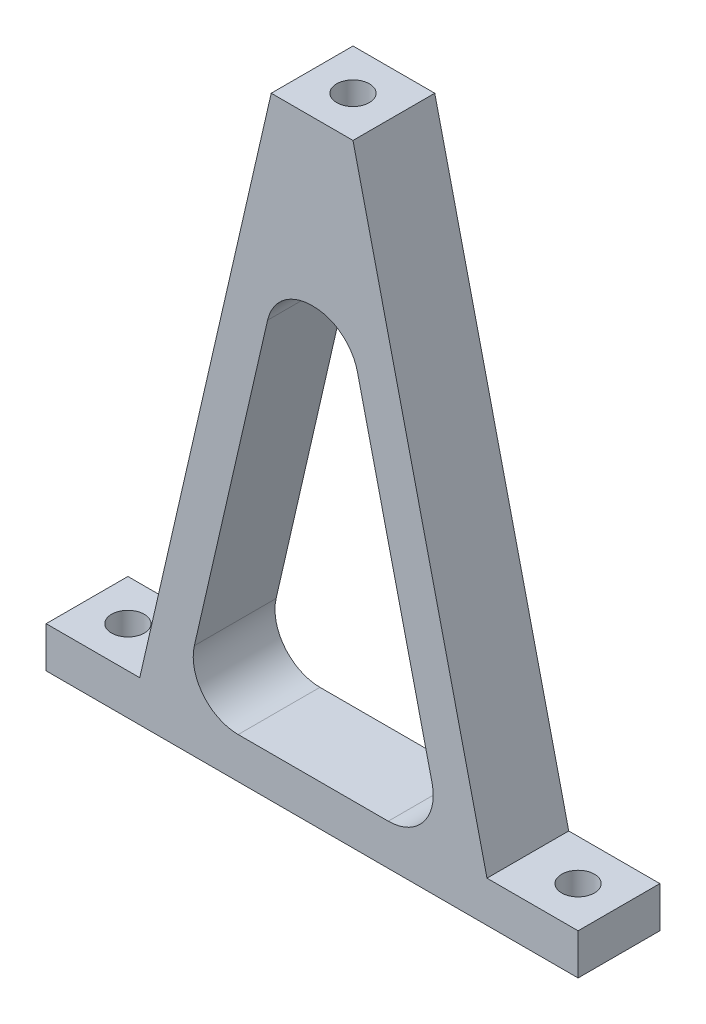
from build123d import *

# Parameters (mm, degrees)
BOSS_EXTRUDE1_DEPTH            = 3
BOSS_EXTRUDE1_DEPTH_BACK       = 7
BOSS_EXTRUDE2_DEPTH            = 3
BOSS_EXTRUDE2_DEPTH_BACK       = 7
SKETCH1_3_W                    = 65.055522872
SKETCH1_3_H                    = 5
CUT_EXTRUDE1_REACH             = 79.455
SKETCH2_R                      = 2
CUT_EXTRUDE2_REACH             = 62.059
CUT_EXTRUDE2_DIRECTION_2_REACH = 62.059
FILLET4_R                      = 5.5
CUT_EXTRUDE3_REACH             = 83.998
SKETCH4_R                      = 2


with BuildPart() as part:
    # Sketch1 → Boss-Extrude1 (new, two sides: drawn at the far end of the back side and taken through both)
    with BuildSketch(Plane.XY.offset(-BOSS_EXTRUDE1_DEPTH_BACK)):
        Polygon((5, 24.943962348), (-5, 24.943962348), (-21.080707518, -45), (21.383633098, -45), align=None)
    extrude(amount=BOSS_EXTRUDE1_DEPTH + BOSS_EXTRUDE1_DEPTH_BACK)

    # Sketch1<3> → Boss-Extrude2 (add, two sides: drawn at the far end of the back side and taken through both)
    with BuildSketch(Plane.XY.offset(-BOSS_EXTRUDE2_DEPTH_BACK)):
        with Locations((0, -47.5)):
            Rectangle(SKETCH1_3_W, SKETCH1_3_H)
    extrude(amount=BOSS_EXTRUDE2_DEPTH + BOSS_EXTRUDE2_DEPTH_BACK)

    # Sketch2 → Cut-Extrude1 (cut, up to next)
    with BuildSketch(Plane(origin=(0, -45, 0), x_dir=(1, 0, 0), z_dir=(0, 1, 0)), mode=Mode.PRIVATE) as cut_extrude1_sk1:
        with Locations((-27.527761436, 2)):
            Circle(SKETCH2_R)
    cut_extrude1_tool1 = extrude(cut_extrude1_sk1.sketch, amount=-CUT_EXTRUDE1_REACH, mode=Mode.PRIVATE) & part.part
    # Sketch2 → Cut-Extrude1 (cut, up to next)
    with BuildSketch(Plane(origin=(0, -45, 0), x_dir=(1, 0, 0), z_dir=(0, 1, 0)), mode=Mode.PRIVATE) as cut_extrude1_sk2:
        with Locations((27.527761436, 2)):
            Circle(SKETCH2_R)
    cut_extrude1_tool2 = extrude(cut_extrude1_sk2.sketch, amount=-CUT_EXTRUDE1_REACH, mode=Mode.PRIVATE) & part.part
    add(cut_extrude1_tool1.solids().sort_by_distance((-27.527761, -45, -2))[0], mode=Mode.SUBTRACT)
    add(cut_extrude1_tool2.solids().sort_by_distance((27.527761, -45, -2))[0], mode=Mode.SUBTRACT)

    # Sketch3 → Cut-Extrude2 (cut, up to next)
    with BuildSketch(Plane.XY, mode=Mode.PRIVATE) as cut_extrude2_sk1:
        Polygon((-4.467725682, 4.943962348), (4.549449769, 4.943962348), (16.248294489, -45), (-15.95026433, -45), align=None)
    cut_extrude2_tool1 = extrude(cut_extrude2_sk1.sketch, amount=-CUT_EXTRUDE2_REACH, mode=Mode.PRIVATE) & part.part
    add(cut_extrude2_tool1.solids().sort_by_distance((0.105077, -24.709767, 0))[0], mode=Mode.SUBTRACT)

    # Sketch3 → Cut-Extrude2 direction 2 (cut, up to next)
    with BuildSketch(Plane.XY, mode=Mode.PRIVATE) as cut_extrude2_direction_2_sk1:
        Polygon((-4.467725682, 4.943962348), (4.549449769, 4.943962348), (16.248294489, -45), (-15.95026433, -45), align=None)
    cut_extrude2_direction_2_tool1 = extrude(cut_extrude2_direction_2_sk1.sketch, amount=CUT_EXTRUDE2_DIRECTION_2_REACH, mode=Mode.PRIVATE) & part.part
    add(cut_extrude2_direction_2_tool1.solids().sort_by_distance((0.105077, -24.709767, 0))[0], mode=Mode.SUBTRACT)

    # Fillet4
    fillet4_edges = [part.edges().sort_by_distance(p)[0] for p in [
        (16.248294489, -45, -2),
        (-15.95026433, -45, -2),
        (-4.467725682, 4.943962348, -2),
        (4.549449769, 4.943962348, -2),
    ]]
    fillet(fillet4_edges, radius=FILLET4_R)

    # Sketch4 → Cut-Extrude3 (cut, up to next)
    with BuildSketch(Plane(origin=(0, 24.943962348, 0), x_dir=(1, 0, 0), z_dir=(0, 1, 0)), mode=Mode.PRIVATE) as cut_extrude3_sk1:
        with Locations((0, 2)):
            Circle(SKETCH4_R)
    cut_extrude3_tool1 = extrude(cut_extrude3_sk1.sketch, amount=-CUT_EXTRUDE3_REACH, mode=Mode.PRIVATE) & part.part
    add(cut_extrude3_tool1.solids().sort_by_distance((0, 24.943962, -2))[0], mode=Mode.SUBTRACT)


solid = part.part
